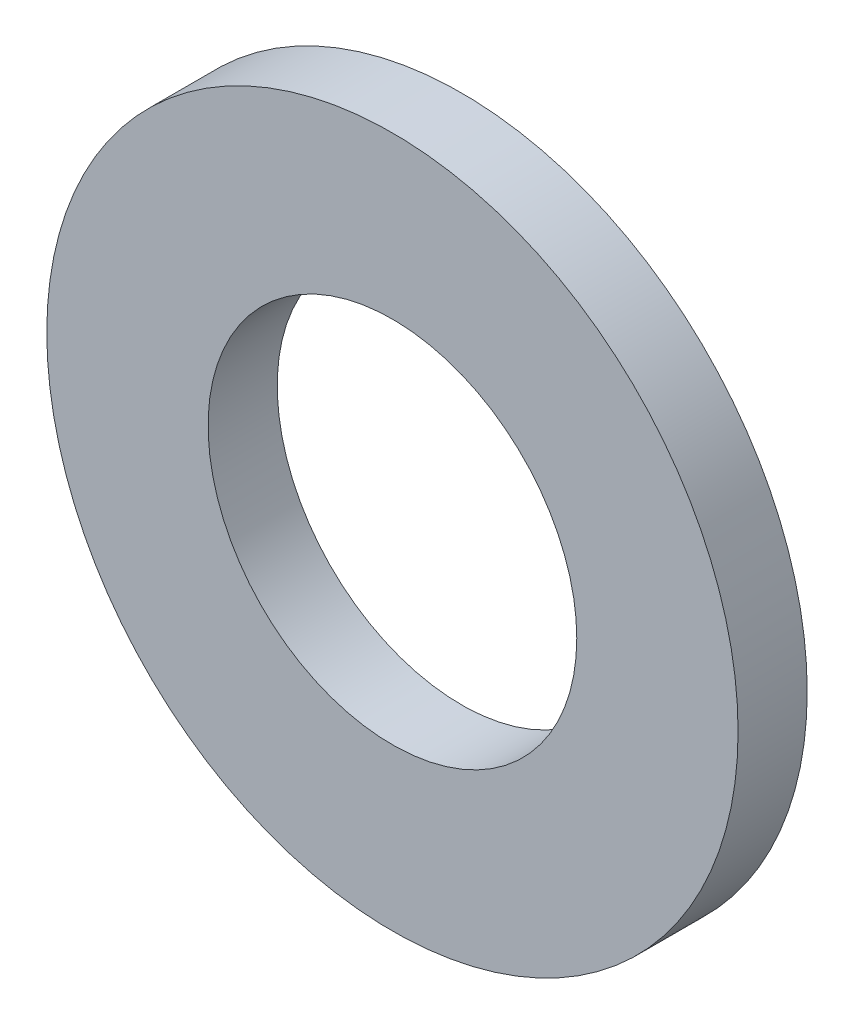
from build123d import *

# Parameters (mm, degrees)
SKETCH_1_R      = 15
SKETCH_1_R_2    = 8
EXTRUDE_1_DEPTH = 3


with BuildPart() as part:
    # 草图1 → 凸台-拉伸1 (new body)
    with BuildSketch(Plane.XY):
        Circle(SKETCH_1_R)
        Circle(SKETCH_1_R_2, mode=Mode.SUBTRACT)
    extrude(amount=EXTRUDE_1_DEPTH)


solid = part.part
